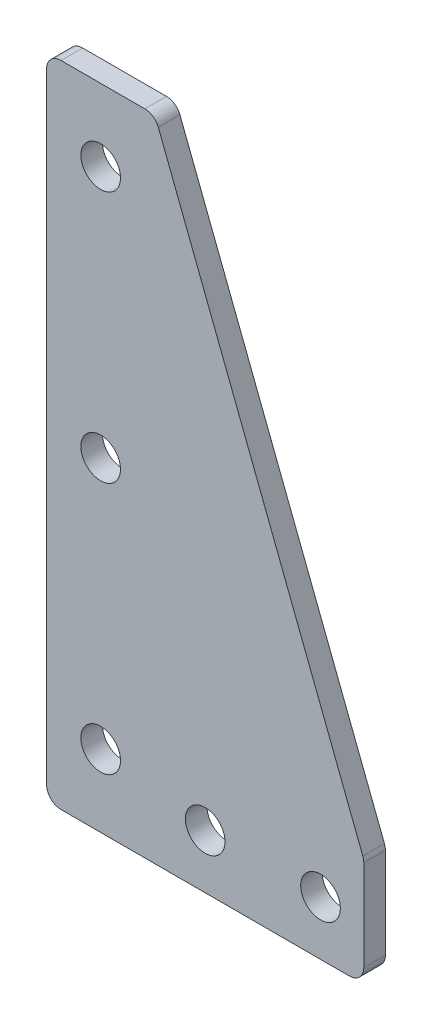
from build123d import *

# Parameters (mm, degrees)
BOSS_EXTRU_1_DEPTH           = 3
ENL_V_MAT_EXTRU_1_DEPTH      = 101.224747443
ENL_V_MAT_EXTRU_1_DEPTH_BACK = 101.224747443
ESQUISSE2_R                  = 2.75
CONG_1_R                     = 2


with BuildPart() as part:
    # Esquisse1 → Boss.-Extru.1 (new body)
    with BuildSketch(Plane.XY):
        Polygon((0, 0), (44, 0), (44, 15), (15, 90), (0, 90), align=None)
    extrude(amount=BOSS_EXTRU_1_DEPTH)

    # Esquisse2 → Enlèv. mat.-Extru.1 (cut, two sides: drawn at the far end of the back side and taken through both)
    with BuildSketch(Plane.XY.offset(3).offset(-ENL_V_MAT_EXTRU_1_DEPTH_BACK)):
        with Locations((7.5, 10)):
            Circle(ESQUISSE2_R)
        with Locations((7.5, 45)):
            Circle(ESQUISSE2_R)
        with Locations((7.5, 80)):
            Circle(ESQUISSE2_R)
        with Locations((22, 7.5)):
            Circle(ESQUISSE2_R)
        with Locations((38, 7.5)):
            Circle(ESQUISSE2_R)
    extrude(amount=ENL_V_MAT_EXTRU_1_DEPTH + ENL_V_MAT_EXTRU_1_DEPTH_BACK, mode=Mode.SUBTRACT)

    # Congé1
    cong_1_edges = [part.edges().sort_by_distance(p)[0] for p in [
        (0, 90, 1.5),
        (15, 90, 1.5),
        (44, 15, 1.5),
        (44, 0, 1.5),
        (0, 0, 1.5),
    ]]
    fillet(cong_1_edges, radius=CONG_1_R)


solid = part.part
